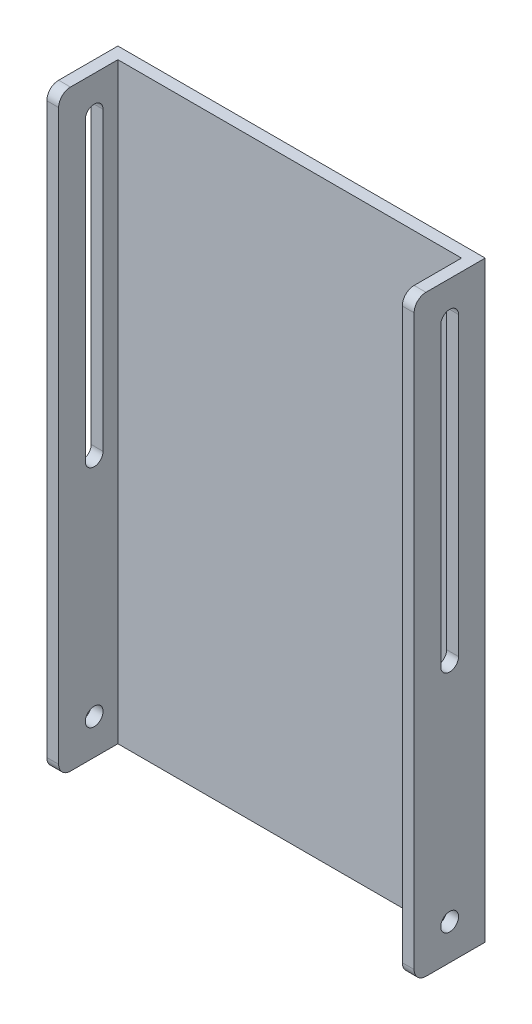
from build123d import *

# Parameters (mm, degrees)
SKETCH1_W           = 500
SKETCH1_H           = 300
BOSS_EXTRUDE1_DEPTH = 10
SKETCH2_W           = 10
SKETCH2_H           = 60
EXTRUDE_THIN1_DEPTH = 500
SKETCH3_R           = 7.5
CUT_EXTRUDE1_DEPTH  = 403.740611312
FILLET1_R           = 10


with BuildPart() as part:
    # Sketch1 → Boss-Extrude1 (new body)
    with BuildSketch(Plane(origin=(0, 0, 0), x_dir=(0, 1, 0), z_dir=(0, 0, 1))):
        Rectangle(SKETCH1_W, SKETCH1_H)
    extrude(amount=BOSS_EXTRUDE1_DEPTH)

    # Sketch2 → Extrude-Thin1 (add)
    with BuildSketch(Plane.XZ.offset(250)):
        with Locations((-150, 30)):
            Rectangle(SKETCH2_W, SKETCH2_H)
        with Locations((150, 30)):
            Rectangle(SKETCH2_W, SKETCH2_H)
    extrude(amount=-EXTRUDE_THIN1_DEPTH)

    # Sketch3 → Cut-Extrude1 (cut, through all)
    with BuildSketch(Plane.YZ.offset(155)):
        with Locations(Location((-220, 30, 0), (0, 0, 270))):
            Circle(SKETCH3_R)
        with BuildLine():
            Line((-30, 37.5), (220, 37.5))
            ThreePointArc((220, 37.5), (227.5, 30), (220, 22.5))
            Line((220, 22.5), (-30, 22.5))
            ThreePointArc((-30, 22.5), (-37.5, 30), (-30, 37.5))
        make_face()
    extrude(amount=-CUT_EXTRUDE1_DEPTH, mode=Mode.SUBTRACT)

    # Fillet1
    fillet1_edges = [part.edges().sort_by_distance(p)[0] for p in [
        (-150, 250, 60),
        (-150, -250, 60),
        (150, 250, 60),
        (150, -250, 60),
    ]]
    fillet(fillet1_edges, radius=FILLET1_R)


solid = part.part
